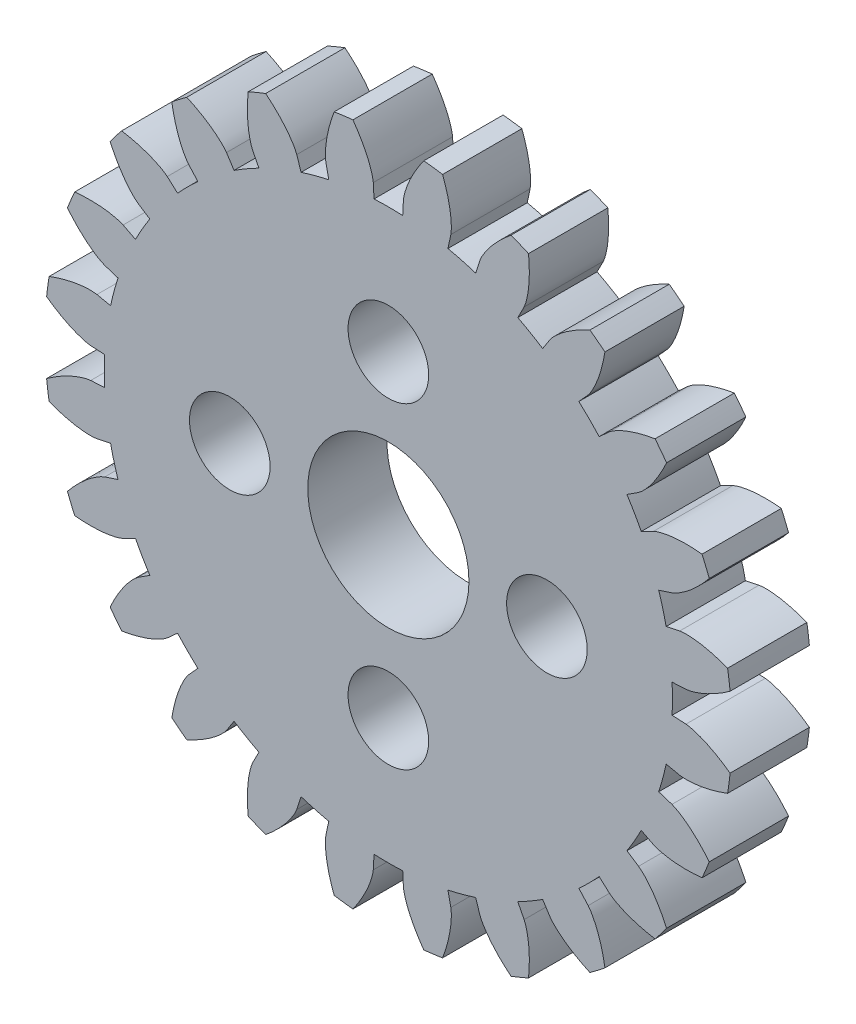
from build123d import *

# Parameters (mm, degrees)
EXTRUDE_1284_DEPTH          = 3
SKETCH_1369_R               = 37.176964918
SKETCH_1369_R_2             = 13
CUT_EXTRUDE_1710_DEPTH      = 39.958796332
CUT_EXTRUDE_2230_DEPTH      = 19.579565852
PATTERN_CIRCULAR_2333_COUNT = 24
SKETCH_2393_R               = 10.75
EXTRUDE_2716_DEPTH          = 3
SKETCH_3280_R               = 3.05
CUT_EXTRUDE_3931_DEPTH      = 19.53106928
SKETCH_1_R                  = 1.525
CUT_EXTRUDE_1_DEPTH         = 19.53106928


with BuildPart() as part:
    # Sketch 1102 → Extrude 1284 (new body)
    with BuildSketch(Plane.XY):
        with BuildLine():
            Line((-34.810597513, -13.051782304), (0.569734248, -11.261909376))
            Line((0.569734248, -11.261909376), (0, 0))
            Line((0, 0), (0, 10.73627013))
            Line((0, 10.73627013), (-0.543142427, 10.73627013))
            Line((-0.543142427, 10.73627013), (-0.569734248, 11.261909376))
            add(Edge.make_bspline(
                [(-0.569734248, 11.261909376), (-0.574039502, 11.304625169), (-0.58662303, 11.389421174), (-0.624880247, 11.548358684), (-0.699627222, 11.777149717), (-0.859532749, 12.161314431), (-1.181341371, 12.739542336), (-1.715210789, 13.454141194), (-2.596612446, 14.335278698), (-3.772336404, 15.202010857), (-5.187237475, 15.95872787), (-6.809569767, 16.555777813), (-8.492340771, 16.947544831), (-10.208004345, 17.146764125), (-12.020014461, 17.16644959), (-14.254309753, 16.95681711), (-16.868761299, 16.366827226), (-19.775097999, 15.244890591), (-22.771942042, 13.514750583), (-25.487635614, 11.372766715), (-27.888534211, 8.884747483), (-29.693862981, 6.45824407), (-31.021257748, 4.235120958), (-31.978360814, 2.303342818), (-32.653986842, 0.71630306), (-33.239321095, -0.905719929), (-33.734316195, -2.558294353), (-34.240622895, -4.652865116), (-34.597645337, -6.781899268), (-34.786628973, -8.711035209), (-34.848980667, -10.330102594), (-34.857641242, -11.185847128), (-34.853055083, -11.769522442), (-34.844894707, -12.225859488), (-34.828408969, -12.671101001), (-34.816961727, -12.925981196), (-34.810597513, -13.051782304)],
                knots=[0, 0, 0, 0, 0, 0.002802034, 0.005604068, 0.010661158, 0.015718248, 0.029959916, 0.048733667, 0.068727063, 0.096888892, 0.125050566, 0.153212235, 0.18137365, 0.209534907, 0.23769631, 0.271429412, 0.327752301, 0.384075274, 0.440398193, 0.496721184, 0.553044153, 0.609367123, 0.637528617, 0.665690111, 0.693851566, 0.72201302, 0.750174495, 0.77833597, 0.834658858, 0.862820432, 0.876901219, 0.883941612, 0.890982006, 0.90003647, 0.909090935, 0.909090935, 0.909090935, 0.909090935, 0.909090935], degree=4))
        make_face()
    extrude(amount=EXTRUDE_1284_DEPTH)

    # Mirror 1330: part across plane


with BuildPart() as part_1:
    add(part.part)
    add(part.part.mirror(Plane(origin=(0, 0, 3), x_dir=(0, 0, 1), z_dir=(1, 0, 0))))

    # Sketch 1369 → Cut-Extrude 1710 (cut, through all)
    with BuildSketch(Plane.XY.offset(3)):
        Circle(SKETCH_1369_R)
        Circle(SKETCH_1369_R_2, mode=Mode.SUBTRACT)
    extrude(amount=-CUT_EXTRUDE_1710_DEPTH, mode=Mode.SUBTRACT)

    # Sketch 1870 → Cut-Extrude 2230 (cut, through all)
    with BuildSketch(Plane.XY.offset(3)):
        with BuildLine():
            Line((-1.696840499, 12.888783198), (0, 0))
            Line((0, 0), (1.696840499, 12.888783198))
            ThreePointArc((1.696840499, 12.888783198), (0, -13), (-1.696840499, 12.888783198))
        make_face()
    extrude(amount=-CUT_EXTRUDE_2230_DEPTH, mode=Mode.SUBTRACT)


with BuildPart() as pattern_circular_2333_1:
    # Pattern Circular 2333: pattern copy
    add(part_1.part.rotate(Axis((0, 0, 0), (0, 0, 1)), 1 * 360 / PATTERN_CIRCULAR_2333_COUNT))


with BuildPart() as pattern_circular_2333_2:
    # Pattern Circular 2333: pattern copy
    add(part_1.part.rotate(Axis((0, 0, 0), (0, 0, 1)), 2 * 360 / PATTERN_CIRCULAR_2333_COUNT))


with BuildPart() as pattern_circular_2333_3:
    # Pattern Circular 2333: pattern copy
    add(part_1.part.rotate(Axis((0, 0, 0), (0, 0, 1)), 3 * 360 / PATTERN_CIRCULAR_2333_COUNT))


with BuildPart() as pattern_circular_2333_4:
    # Pattern Circular 2333: pattern copy
    add(part_1.part.rotate(Axis((0, 0, 0), (0, 0, 1)), 4 * 360 / PATTERN_CIRCULAR_2333_COUNT))


with BuildPart() as pattern_circular_2333_5:
    # Pattern Circular 2333: pattern copy
    add(part_1.part.rotate(Axis((0, 0, 0), (0, 0, 1)), 5 * 360 / PATTERN_CIRCULAR_2333_COUNT))


with BuildPart() as pattern_circular_2333_6:
    # Pattern Circular 2333: pattern copy
    add(part_1.part.rotate(Axis((0, 0, 0), (0, 0, 1)), 6 * 360 / PATTERN_CIRCULAR_2333_COUNT))


with BuildPart() as pattern_circular_2333_7:
    # Pattern Circular 2333: pattern copy
    add(part_1.part.rotate(Axis((0, 0, 0), (0, 0, 1)), 7 * 360 / PATTERN_CIRCULAR_2333_COUNT))


with BuildPart() as pattern_circular_2333_8:
    # Pattern Circular 2333: pattern copy
    add(part_1.part.rotate(Axis((0, 0, 0), (0, 0, 1)), 8 * 360 / PATTERN_CIRCULAR_2333_COUNT))


with BuildPart() as pattern_circular_2333_9:
    # Pattern Circular 2333: pattern copy
    add(part_1.part.rotate(Axis((0, 0, 0), (0, 0, 1)), 9 * 360 / PATTERN_CIRCULAR_2333_COUNT))


with BuildPart() as pattern_circular_2333_10:
    # Pattern Circular 2333: pattern copy
    add(part_1.part.rotate(Axis((0, 0, 0), (0, 0, 1)), 10 * 360 / PATTERN_CIRCULAR_2333_COUNT))


with BuildPart() as pattern_circular_2333_11:
    # Pattern Circular 2333: pattern copy
    add(part_1.part.rotate(Axis((0, 0, 0), (0, 0, 1)), 11 * 360 / PATTERN_CIRCULAR_2333_COUNT))


with BuildPart() as pattern_circular_2333_12:
    # Pattern Circular 2333: pattern copy
    add(part_1.part.rotate(Axis((0, 0, 0), (0, 0, 1)), 12 * 360 / PATTERN_CIRCULAR_2333_COUNT))


with BuildPart() as pattern_circular_2333_13:
    # Pattern Circular 2333: pattern copy
    add(part_1.part.rotate(Axis((0, 0, 0), (0, 0, 1)), 13 * 360 / PATTERN_CIRCULAR_2333_COUNT))


with BuildPart() as pattern_circular_2333_14:
    # Pattern Circular 2333: pattern copy
    add(part_1.part.rotate(Axis((0, 0, 0), (0, 0, 1)), 14 * 360 / PATTERN_CIRCULAR_2333_COUNT))


with BuildPart() as pattern_circular_2333_15:
    # Pattern Circular 2333: pattern copy
    add(part_1.part.rotate(Axis((0, 0, 0), (0, 0, 1)), 15 * 360 / PATTERN_CIRCULAR_2333_COUNT))


with BuildPart() as pattern_circular_2333_16:
    # Pattern Circular 2333: pattern copy
    add(part_1.part.rotate(Axis((0, 0, 0), (0, 0, 1)), 16 * 360 / PATTERN_CIRCULAR_2333_COUNT))


with BuildPart() as pattern_circular_2333_17:
    # Pattern Circular 2333: pattern copy
    add(part_1.part.rotate(Axis((0, 0, 0), (0, 0, 1)), 17 * 360 / PATTERN_CIRCULAR_2333_COUNT))


with BuildPart() as pattern_circular_2333_18:
    # Pattern Circular 2333: pattern copy
    add(part_1.part.rotate(Axis((0, 0, 0), (0, 0, 1)), 18 * 360 / PATTERN_CIRCULAR_2333_COUNT))


with BuildPart() as pattern_circular_2333_19:
    # Pattern Circular 2333: pattern copy
    add(part_1.part.rotate(Axis((0, 0, 0), (0, 0, 1)), 19 * 360 / PATTERN_CIRCULAR_2333_COUNT))


with BuildPart() as pattern_circular_2333_20:
    # Pattern Circular 2333: pattern copy
    add(part_1.part.rotate(Axis((0, 0, 0), (0, 0, 1)), 20 * 360 / PATTERN_CIRCULAR_2333_COUNT))


with BuildPart() as pattern_circular_2333_21:
    # Pattern Circular 2333: pattern copy
    add(part_1.part.rotate(Axis((0, 0, 0), (0, 0, 1)), 21 * 360 / PATTERN_CIRCULAR_2333_COUNT))


with BuildPart() as pattern_circular_2333_22:
    # Pattern Circular 2333: pattern copy
    add(part_1.part.rotate(Axis((0, 0, 0), (0, 0, 1)), 22 * 360 / PATTERN_CIRCULAR_2333_COUNT))


with BuildPart() as pattern_circular_2333_23:
    # Pattern Circular 2333: pattern copy
    add(part_1.part.rotate(Axis((0, 0, 0), (0, 0, 1)), 23 * 360 / PATTERN_CIRCULAR_2333_COUNT))


with BuildPart() as part_2:
    add(part_1.part)

    add(pattern_circular_2333_1.part)  # Extrude 2716 merges Pattern Circular 2333_1

    add(pattern_circular_2333_2.part)  # Extrude 2716 merges Pattern Circular 2333_2

    add(pattern_circular_2333_3.part)  # Extrude 2716 merges Pattern Circular 2333_3

    add(pattern_circular_2333_4.part)  # Extrude 2716 merges Pattern Circular 2333_4

    add(pattern_circular_2333_5.part)  # Extrude 2716 merges Pattern Circular 2333_5

    add(pattern_circular_2333_6.part)  # Extrude 2716 merges Pattern Circular 2333_6

    add(pattern_circular_2333_7.part)  # Extrude 2716 merges Pattern Circular 2333_7

    add(pattern_circular_2333_8.part)  # Extrude 2716 merges Pattern Circular 2333_8

    add(pattern_circular_2333_9.part)  # Extrude 2716 merges Pattern Circular 2333_9

    add(pattern_circular_2333_10.part)  # Extrude 2716 merges Pattern Circular 2333_10

    add(pattern_circular_2333_11.part)  # Extrude 2716 merges Pattern Circular 2333_11

    add(pattern_circular_2333_12.part)  # Extrude 2716 merges Pattern Circular 2333_12

    add(pattern_circular_2333_13.part)  # Extrude 2716 merges Pattern Circular 2333_13

    add(pattern_circular_2333_14.part)  # Extrude 2716 merges Pattern Circular 2333_14

    add(pattern_circular_2333_15.part)  # Extrude 2716 merges Pattern Circular 2333_15

    add(pattern_circular_2333_16.part)  # Extrude 2716 merges Pattern Circular 2333_16

    add(pattern_circular_2333_17.part)  # Extrude 2716 merges Pattern Circular 2333_17

    add(pattern_circular_2333_18.part)  # Extrude 2716 merges Pattern Circular 2333_18

    add(pattern_circular_2333_19.part)  # Extrude 2716 merges Pattern Circular 2333_19

    add(pattern_circular_2333_20.part)  # Extrude 2716 merges Pattern Circular 2333_20

    add(pattern_circular_2333_21.part)  # Extrude 2716 merges Pattern Circular 2333_21

    add(pattern_circular_2333_22.part)  # Extrude 2716 merges Pattern Circular 2333_22

    add(pattern_circular_2333_23.part)  # Extrude 2716 merges Pattern Circular 2333_23
    # Sketch 2393 → Extrude 2716 (add, through all)
    with BuildSketch(Plane.XY.offset(3)):
        Circle(SKETCH_2393_R)
    extrude(amount=-EXTRUDE_2716_DEPTH)

    # Sketch 3280 → Cut-Extrude 3931 (cut, through all)
    with BuildSketch(Plane.XY.offset(3)):
        Circle(SKETCH_3280_R)
    extrude(amount=-CUT_EXTRUDE_3931_DEPTH, mode=Mode.SUBTRACT)

    # ｽｹｯﾁ1 → ｶｯﾄ - 押し出し1 (cut, through all)
    with BuildSketch(Plane.XY.offset(3)):
        with Locations((6, 0)):
            Circle(SKETCH_1_R)
        with Locations((0, -6)):
            Circle(SKETCH_1_R)
        with Locations((-6, 0)):
            Circle(SKETCH_1_R)
        with Locations((0, 6)):
            Circle(SKETCH_1_R)
    extrude(amount=-CUT_EXTRUDE_1_DEPTH, mode=Mode.SUBTRACT)


solid = part_2.part
